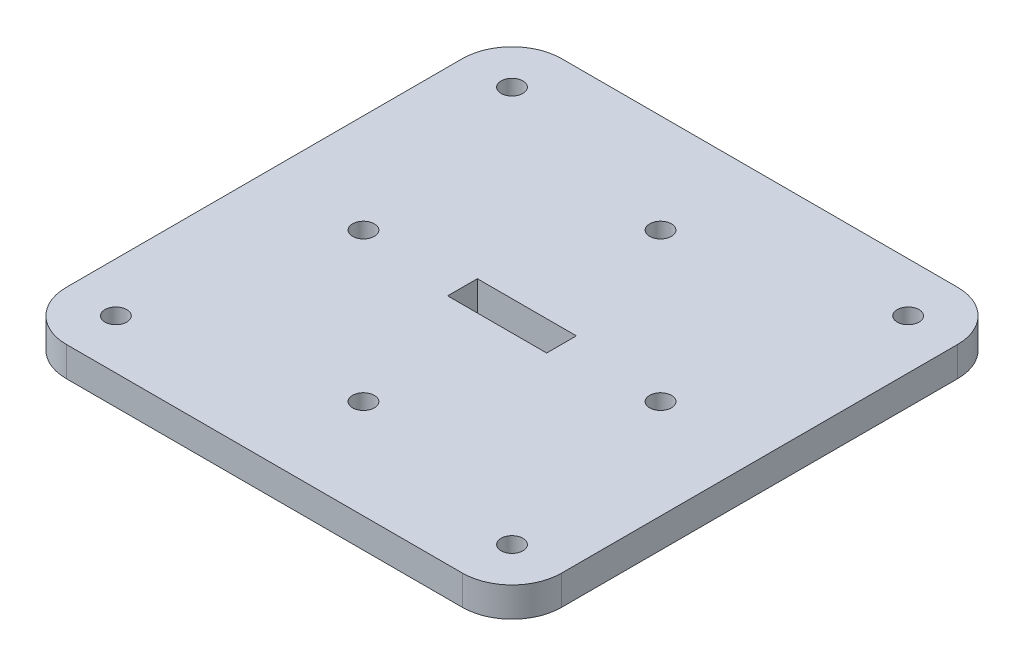
from build123d import *

# Parameters (mm, degrees)
SKETCH1_W           = 50
SKETCH1_H           = 50
SKETCH1_R           = 1.1
SKETCH1_W_2         = 10
SKETCH1_H_2         = 3
BOSS_EXTRUDE1_DEPTH = 3
FILLET1_R           = 5


with BuildPart() as part:
    # Sketch1 → Boss-Extrude1 (new body)
    with BuildSketch(Plane(origin=(0, 0, 0), x_dir=(1, 0, 0), z_dir=(0, 1, 0))):
        Rectangle(SKETCH1_W, SKETCH1_H)
        with Locations(Location((-15, 0, 0), (0, 0, 270))):
            Circle(SKETCH1_R, mode=Mode.SUBTRACT)
        with Locations(Location((15, 0, 0), (0, 0, 90))):
            Circle(SKETCH1_R, mode=Mode.SUBTRACT)
        with Locations(Location((-20, 20, 0), (0, 0, 270))):
            Circle(SKETCH1_R, mode=Mode.SUBTRACT)
        with Locations(Location((20, 20, 0), (0, 0, 90))):
            Circle(SKETCH1_R, mode=Mode.SUBTRACT)
        with Locations(Location((20, -20, 0), (0, 0, 270))):
            Circle(SKETCH1_R, mode=Mode.SUBTRACT)
        with Locations(Location((-20, -20, 0), (0, 0, 90))):
            Circle(SKETCH1_R, mode=Mode.SUBTRACT)
        with Locations(Location((0, 15, 0), (0, 0, 270))):
            Circle(SKETCH1_R, mode=Mode.SUBTRACT)
        with Locations(Location((0, -15, 0), (0, 0, 90))):
            Circle(SKETCH1_R, mode=Mode.SUBTRACT)
        Rectangle(SKETCH1_W_2, SKETCH1_H_2, mode=Mode.SUBTRACT)
    extrude(amount=BOSS_EXTRUDE1_DEPTH)

    # Fillet1
    fillet1_edges = [part.edges().sort_by_distance(p)[0] for p in [
        (25, 1.5, 25),
        (-25, 1.5, 25),
        (-25, 1.5, -25),
        (25, 1.5, -25),
    ]]
    fillet(fillet1_edges, radius=FILLET1_R)


solid = part.part
